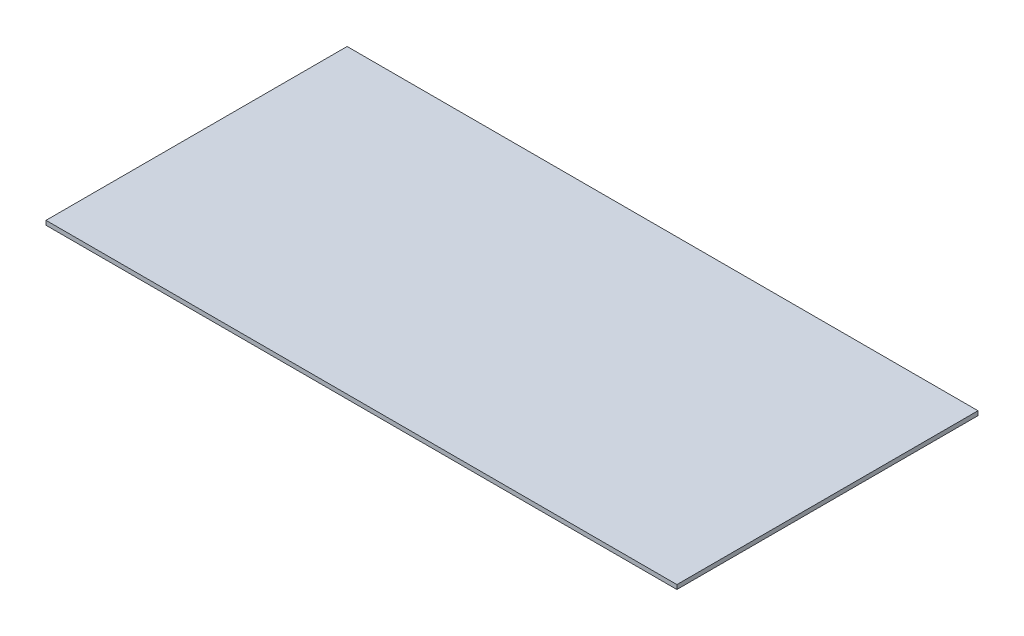
from build123d import *

# Parameters (mm, degrees)
SKETCH1_W           = 880
SKETCH1_H           = 420
BOSS_EXTRUDE1_DEPTH = 6


with BuildPart() as part:
    # Sketch1 → Boss-Extrude1 (new body)
    with BuildSketch(Plane(origin=(0, 0, 0), x_dir=(1, 0, 0), z_dir=(0, 1, 0))):
        with Locations((440, 210)):
            Rectangle(SKETCH1_W, SKETCH1_H)
    extrude(amount=BOSS_EXTRUDE1_DEPTH)


solid = part.part
